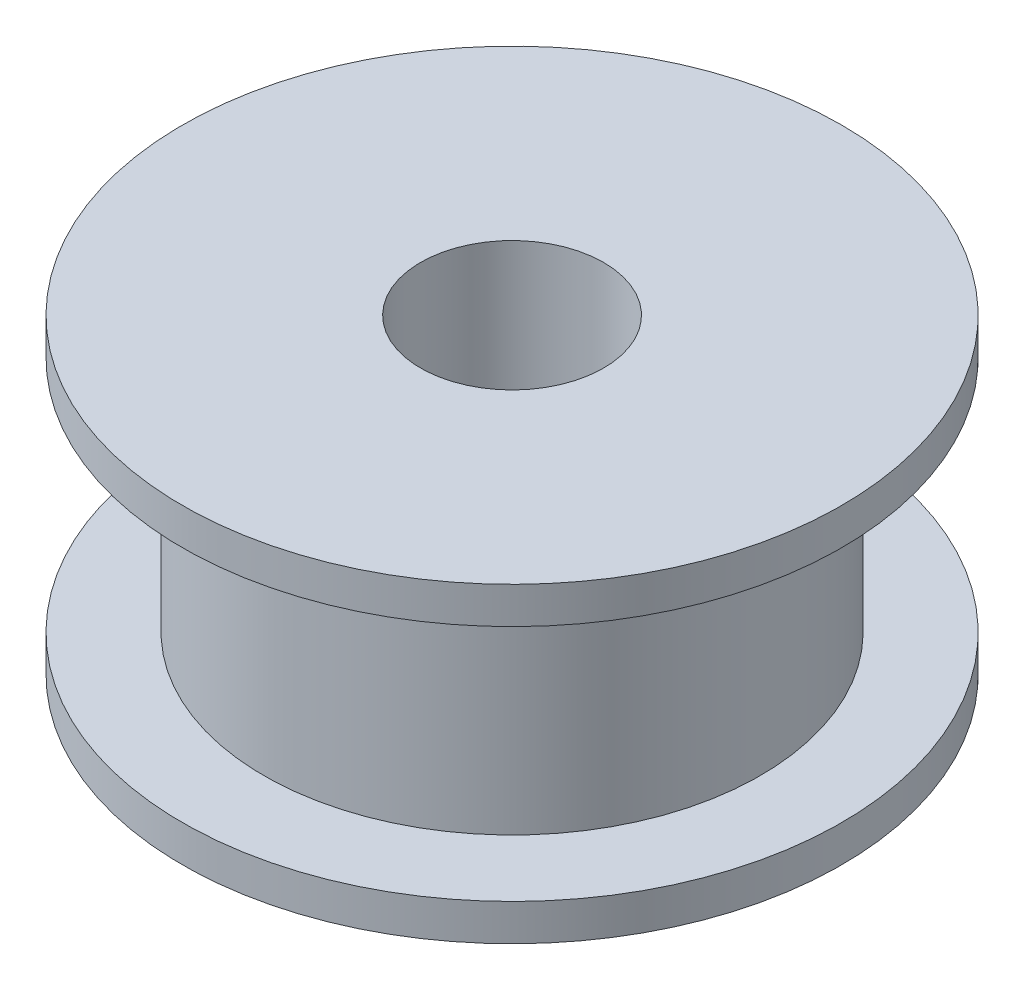
from build123d import *


with BuildPart() as part:
    # Sketch1 → Revolve1 (revolve)
    with BuildSketch(Plane.XY, mode=Mode.PRIVATE) as revolve1_sk:
        Polygon((2.5, 4.25), (9, 4.25), (9, 3.25), (6.777827795, 3.25), (6.777827795, -3.25), (9, -3.25), (9, -4.25), (2.5, -4.25), align=None)
    revolve(revolve1_sk.sketch.rotate(Axis((0, 0, 0), (0, 1, 0)), 90), axis=Axis((0, 0, 0), (0, 1, 0)))


solid = part.part
